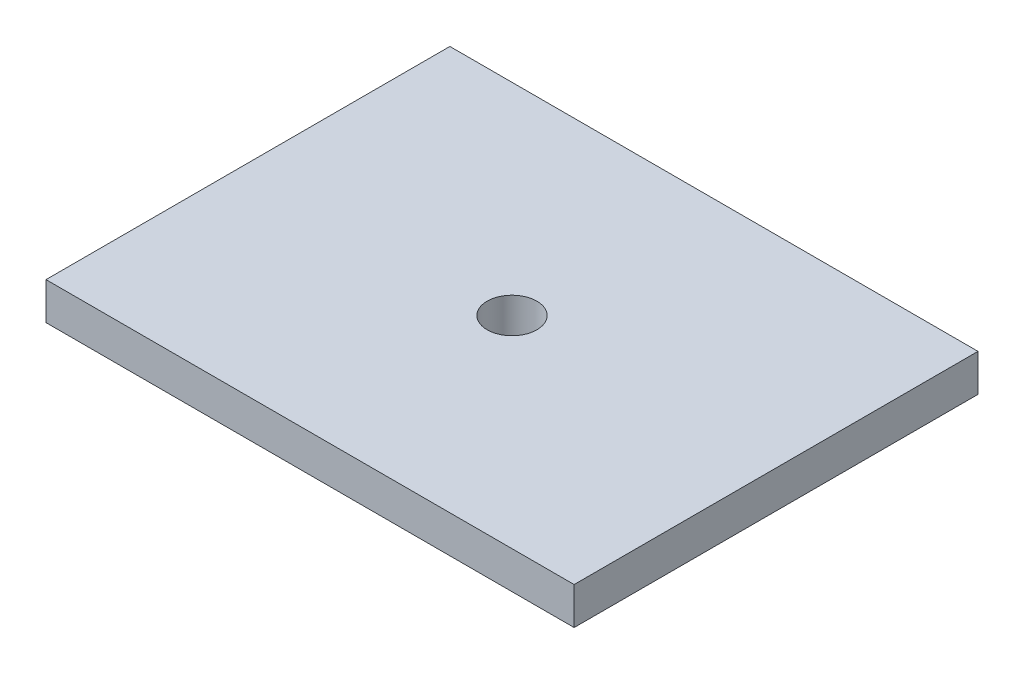
from build123d import *

# Parameters (mm, degrees)
SKETCH_1_W          = 85
SKETCH_1_H          = 65
EXTRUDE_1_DEPTH     = 6
SKETCH_3_R          = 4
CUT_EXTRUDE_2_DEPTH = 75.861411438


with BuildPart() as part:
    # Эскиз1 → Вытянуть1 (new body)
    with BuildSketch(Plane(origin=(0, 0, 0), x_dir=(1, 0, 0), z_dir=(0, 1, 0))):
        with Locations((0, -28.834989382)):
            Rectangle(SKETCH_1_W, SKETCH_1_H)
    extrude(amount=EXTRUDE_1_DEPTH)

    # Эскиз3 → Вырез-Вытянуть2 (cut, through all)
    with BuildSketch(Plane(origin=(0, 6, 0), x_dir=(1, 0, 0), z_dir=(0, 1, 0))):
        with Locations(Location((0, -28.834989382, 0), (0, 0, 270))):
            Circle(SKETCH_3_R)
    extrude(amount=-CUT_EXTRUDE_2_DEPTH, mode=Mode.SUBTRACT)


solid = part.part
